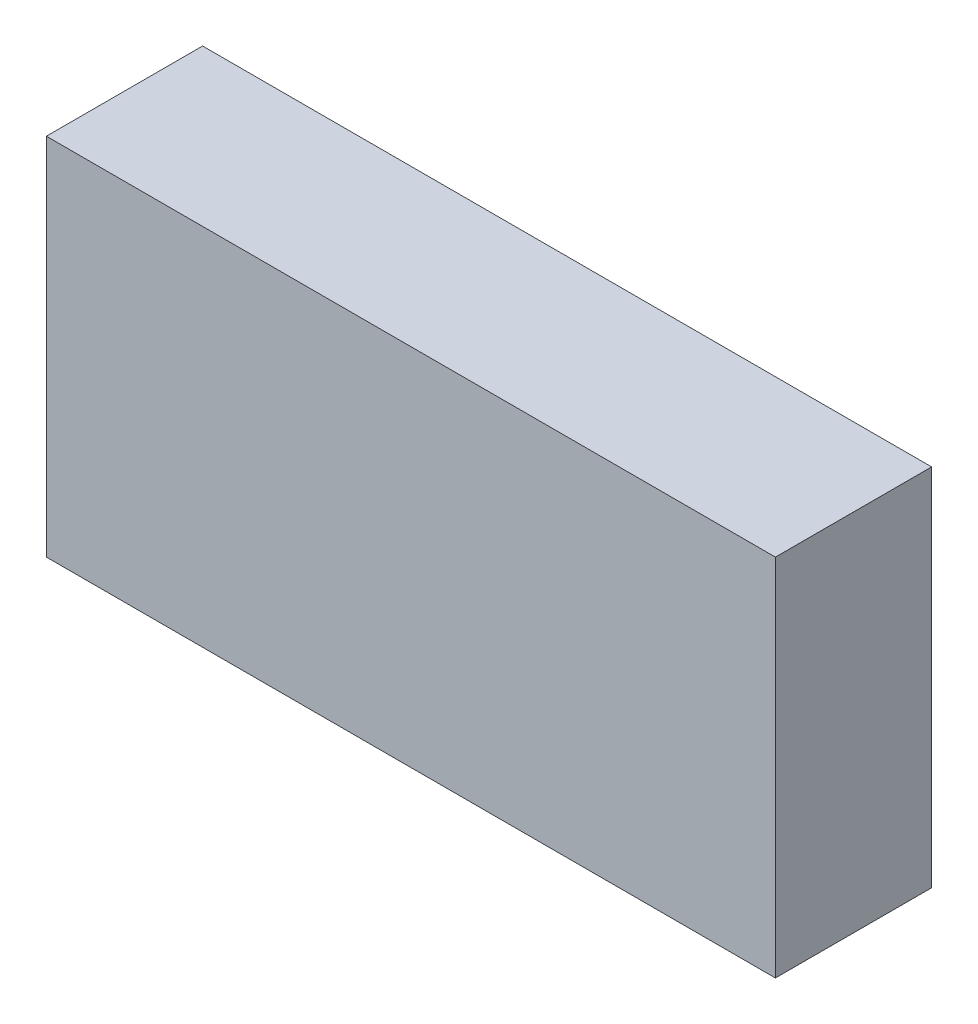
from build123d import *

# Parameters (mm, degrees)
SKETCH_1_W      = 70
SKETCH_1_H      = 35
EXTRUDE_1_DEPTH = 15


with BuildPart() as part:
    # ｽｹｯﾁ1 → ﾎﾞｽ - 押し出し1 (new body)
    with BuildSketch(Plane.XY):
        with Locations((35, 17.5)):
            Rectangle(SKETCH_1_W, SKETCH_1_H)
    extrude(amount=EXTRUDE_1_DEPTH)


solid = part.part
